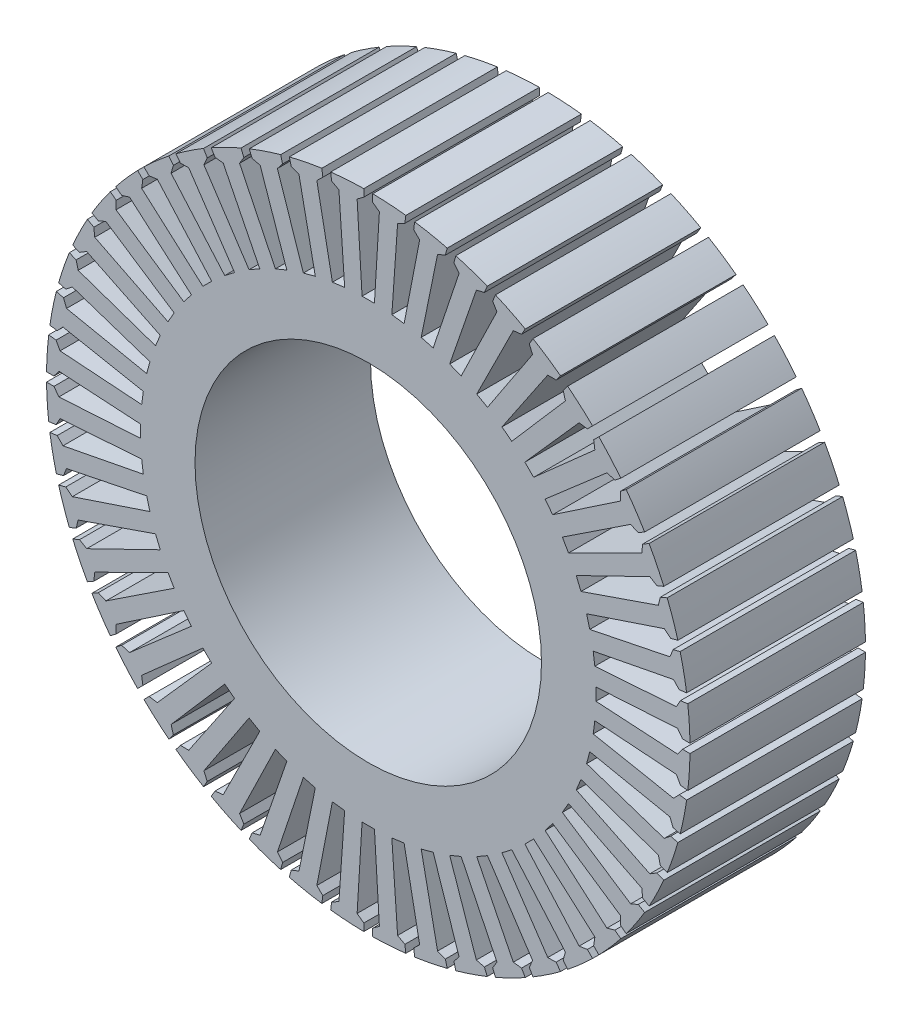
from build123d import *

# Parameters (mm, degrees)
STATOR_STACK_START    = -15
SKETCH_1_R            = 55
SKETCH_1_R_2          = 29.615384615
STATOR_STACK_DEPTH    = 30
STATOR_48_SLOTS_DEPTH = 16


with BuildPart() as part:
    # Эскиз1 → Stator_stack (new body)
    with BuildSketch(Plane.XY.offset(STATOR_STACK_START)):
        Circle(SKETCH_1_R)
        Circle(SKETCH_1_R_2, mode=Mode.SUBTRACT)
    extrude(amount=STATOR_STACK_DEPTH)

    # Эскиз2 → Stator_48_slots (cut, symmetric)
    with BuildSketch(Plane.XY):
        Polygon((55.994821717, -0.761538462), (53.730769231, -0.761538462), (52.884615385, -1.903846154), (38.923076923, -1.057692308), (38.923076923, 1.057692308), (52.884615385, 1.903846154), (53.730769231, 0.761538462), (55.994821717, 0.761538462), align=None)
        Polygon((55.615178971, 6.553767468), (53.370495767, 6.258249318), (52.680681958, 5.015268987), (38.728141154, 4.031837417), (38.452028055, 6.129124624), (52.18367838, 8.790385959), (53.171694336, 7.768296107), (55.41637754, 8.063814257), align=None)
        Polygon((54.283945093, 13.75693662), (52.097038324, 13.170956717), (51.575367457, 11.848571485), (37.870556152, 9.052381285), (37.323054326, 11.095685918), (50.58986417, 15.526519824), (51.702837009, 14.642136053), (53.889743778, 15.228115955), align=None)
        Polygon((52.023897864, 20.724720772), (49.932186111, 19.858305395), (49.587584119, 18.47914164), (36.364995434, 13.9180364), (35.555472789, 15.87239695), (48.130443358, 21.996990629), (49.349329806, 21.265444991), (51.441041559, 22.131860367), align=None)
        Polygon((48.873707318, 27.337899205), (46.912980349, 26.205872962), (46.751343469, 24.793528558), (34.237219563, 18.545550054), (33.179527255, 20.377526869), (44.847497316, 28.091086826), (46.151441888, 27.524896269), (48.112168857, 28.656922512), align=None)
        Polygon((44.887274091, 33.483318604), (43.091080488, 32.105050776), (43.115174371, 30.683691329), (31.523635372, 22.855744204), (30.235870811, 24.533991654), (40.79719816, 33.70453674), (42.163890004, 33.313388941), (43.960083606, 34.691656768), align=None)
        Polygon((40.132807158, 39.055829137), (38.531880292, 37.454902271), (38.741292685, 36.048847633), (28.27067304, 26.774870234), (26.774870234, 28.27067304), (36.048847633, 38.741292685), (37.454902271, 38.531880292), (39.055829137, 40.132807158), align=None)
        Polygon((34.691656768, 43.960083606), (33.313388941, 42.163890004), (33.70453674, 40.79719816), (24.533991654, 30.235870811), (22.855744204, 31.523635372), (30.683691329, 43.115174371), (32.105050776, 43.091080488), (33.483318604, 44.887274091), align=None)
        Polygon((28.656922512, 48.112168857), (27.524896269, 46.151441888), (28.091086826, 44.847497316), (20.377526869, 33.179527255), (18.545550054, 34.237219563), (24.793528558, 46.751343469), (26.205872962, 46.912980349), (27.337899205, 48.873707318), align=None)
        Polygon((22.131860367, 51.441041559), (21.265444991, 49.349329806), (21.996990629, 48.130443358), (15.87239695, 35.555472789), (13.9180364, 36.364995434), (18.47914164, 49.587584119), (19.858305395, 49.932186111), (20.724720772, 52.023897864), align=None)
        Polygon((15.228115955, 53.889743778), (14.642136053, 51.702837009), (15.526519824, 50.58986417), (11.095685918, 37.323054326), (9.052381285, 37.870556152), (11.848571485, 51.575367457), (13.170956717, 52.097038324), (13.75693662, 54.283945093), align=None)
        Polygon((8.063814257, 55.41637754), (7.768296107, 53.171694336), (8.790385959, 52.18367838), (6.129124624, 38.452028055), (4.031837417, 38.728141154), (5.015268987, 52.680681958), (6.258249318, 53.370495767), (6.553767468, 55.615178971), align=None)
        Polygon((0.761538462, 55.994821717), (0.761538462, 53.730769231), (1.903846154, 52.884615385), (1.057692308, 38.923076923), (-1.057692308, 38.923076923), (-1.903846154, 52.884615385), (-0.761538462, 53.730769231), (-0.761538462, 55.994821717), align=None)
        Polygon((-6.553767468, 55.615178971), (-6.258249318, 53.370495767), (-5.015268987, 52.680681958), (-4.031837417, 38.728141154), (-6.129124624, 38.452028055), (-8.790385959, 52.18367838), (-7.768296107, 53.171694336), (-8.063814257, 55.41637754), align=None)
        Polygon((-13.75693662, 54.283945093), (-13.170956717, 52.097038324), (-11.848571485, 51.575367457), (-9.052381285, 37.870556152), (-11.095685918, 37.323054326), (-15.526519824, 50.58986417), (-14.642136053, 51.702837009), (-15.228115955, 53.889743778), align=None)
        Polygon((-20.724720772, 52.023897864), (-19.858305395, 49.932186111), (-18.47914164, 49.587584119), (-13.9180364, 36.364995434), (-15.87239695, 35.555472789), (-21.996990629, 48.130443358), (-21.265444991, 49.349329806), (-22.131860367, 51.441041559), align=None)
        Polygon((-27.337899205, 48.873707318), (-26.205872962, 46.912980349), (-24.793528558, 46.751343469), (-18.545550054, 34.237219563), (-20.377526869, 33.179527255), (-28.091086826, 44.847497316), (-27.524896269, 46.151441888), (-28.656922512, 48.112168857), align=None)
        Polygon((-33.483318604, 44.887274091), (-32.105050776, 43.091080488), (-30.683691329, 43.115174371), (-22.855744204, 31.523635372), (-24.533991654, 30.235870811), (-33.70453674, 40.79719816), (-33.313388941, 42.163890004), (-34.691656768, 43.960083606), align=None)
        Polygon((-39.055829137, 40.132807158), (-37.454902271, 38.531880292), (-36.048847633, 38.741292685), (-26.774870234, 28.27067304), (-28.27067304, 26.774870234), (-38.741292685, 36.048847633), (-38.531880292, 37.454902271), (-40.132807158, 39.055829137), align=None)
        Polygon((-43.960083606, 34.691656768), (-42.163890004, 33.313388941), (-40.79719816, 33.70453674), (-30.235870811, 24.533991654), (-31.523635372, 22.855744204), (-43.115174371, 30.683691329), (-43.091080488, 32.105050776), (-44.887274091, 33.483318604), align=None)
        Polygon((-48.112168857, 28.656922512), (-46.151441888, 27.524896269), (-44.847497316, 28.091086826), (-33.179527255, 20.377526869), (-34.237219563, 18.545550054), (-46.751343469, 24.793528558), (-46.912980349, 26.205872962), (-48.873707318, 27.337899205), align=None)
        Polygon((-51.441041559, 22.131860367), (-49.349329806, 21.265444991), (-48.130443358, 21.996990629), (-35.555472789, 15.87239695), (-36.364995434, 13.9180364), (-49.587584119, 18.47914164), (-49.932186111, 19.858305395), (-52.023897864, 20.724720772), align=None)
        Polygon((-53.889743778, 15.228115955), (-51.702837009, 14.642136053), (-50.58986417, 15.526519824), (-37.323054326, 11.095685918), (-37.870556152, 9.052381285), (-51.575367457, 11.848571485), (-52.097038324, 13.170956717), (-54.283945093, 13.75693662), align=None)
        Polygon((-55.41637754, 8.063814257), (-53.171694336, 7.768296107), (-52.18367838, 8.790385959), (-38.452028055, 6.129124624), (-38.728141154, 4.031837417), (-52.680681958, 5.015268987), (-53.370495767, 6.258249318), (-55.615178971, 6.553767468), align=None)
        Polygon((-55.994821717, 0.761538462), (-53.730769231, 0.761538462), (-52.884615385, 1.903846154), (-38.923076923, 1.057692308), (-38.923076923, -1.057692308), (-52.884615385, -1.903846154), (-53.730769231, -0.761538462), (-55.994821717, -0.761538462), align=None)
        Polygon((-55.615178971, -6.553767468), (-53.370495767, -6.258249318), (-52.680681958, -5.015268987), (-38.728141154, -4.031837417), (-38.452028055, -6.129124624), (-52.18367838, -8.790385959), (-53.171694336, -7.768296107), (-55.41637754, -8.063814257), align=None)
        Polygon((-54.283945093, -13.75693662), (-52.097038324, -13.170956717), (-51.575367457, -11.848571485), (-37.870556152, -9.052381285), (-37.323054326, -11.095685918), (-50.58986417, -15.526519824), (-51.702837009, -14.642136053), (-53.889743778, -15.228115955), align=None)
        Polygon((-52.023897864, -20.724720772), (-49.932186111, -19.858305395), (-49.587584119, -18.47914164), (-36.364995434, -13.9180364), (-35.555472789, -15.87239695), (-48.130443358, -21.996990629), (-49.349329806, -21.265444991), (-51.441041559, -22.131860367), align=None)
        Polygon((-48.873707318, -27.337899205), (-46.912980349, -26.205872962), (-46.751343469, -24.793528558), (-34.237219563, -18.545550054), (-33.179527255, -20.377526869), (-44.847497316, -28.091086826), (-46.151441888, -27.524896269), (-48.112168857, -28.656922512), align=None)
        Polygon((-44.887274091, -33.483318604), (-43.091080488, -32.105050776), (-43.115174371, -30.683691329), (-31.523635372, -22.855744204), (-30.235870811, -24.533991654), (-40.79719816, -33.70453674), (-42.163890004, -33.313388941), (-43.960083606, -34.691656768), align=None)
        Polygon((-40.132807158, -39.055829137), (-38.531880292, -37.454902271), (-38.741292685, -36.048847633), (-28.27067304, -26.774870234), (-26.774870234, -28.27067304), (-36.048847633, -38.741292685), (-37.454902271, -38.531880292), (-39.055829137, -40.132807158), align=None)
        Polygon((-34.691656768, -43.960083606), (-33.313388941, -42.163890004), (-33.70453674, -40.79719816), (-24.533991654, -30.235870811), (-22.855744204, -31.523635372), (-30.683691329, -43.115174371), (-32.105050776, -43.091080488), (-33.483318604, -44.887274091), align=None)
        Polygon((-28.656922512, -48.112168857), (-27.524896269, -46.151441888), (-28.091086826, -44.847497316), (-20.377526869, -33.179527255), (-18.545550054, -34.237219563), (-24.793528558, -46.751343469), (-26.205872962, -46.912980349), (-27.337899205, -48.873707318), align=None)
        Polygon((-22.131860367, -51.441041559), (-21.265444991, -49.349329806), (-21.996990629, -48.130443358), (-15.87239695, -35.555472789), (-13.9180364, -36.364995434), (-18.47914164, -49.587584119), (-19.858305395, -49.932186111), (-20.724720772, -52.023897864), align=None)
        Polygon((-15.228115955, -53.889743778), (-14.642136053, -51.702837009), (-15.526519824, -50.58986417), (-11.095685918, -37.323054326), (-9.052381285, -37.870556152), (-11.848571485, -51.575367457), (-13.170956717, -52.097038324), (-13.75693662, -54.283945093), align=None)
        Polygon((-8.063814257, -55.41637754), (-7.768296107, -53.171694336), (-8.790385959, -52.18367838), (-6.129124624, -38.452028055), (-4.031837417, -38.728141154), (-5.015268987, -52.680681958), (-6.258249318, -53.370495767), (-6.553767468, -55.615178971), align=None)
        Polygon((-0.761538462, -55.994821717), (-0.761538462, -53.730769231), (-1.903846154, -52.884615385), (-1.057692308, -38.923076923), (1.057692308, -38.923076923), (1.903846154, -52.884615385), (0.761538462, -53.730769231), (0.761538462, -55.994821717), align=None)
        Polygon((6.553767468, -55.615178971), (6.258249318, -53.370495767), (5.015268987, -52.680681958), (4.031837417, -38.728141154), (6.129124624, -38.452028055), (8.790385959, -52.18367838), (7.768296107, -53.171694336), (8.063814257, -55.41637754), align=None)
        Polygon((13.75693662, -54.283945093), (13.170956717, -52.097038324), (11.848571485, -51.575367457), (9.052381285, -37.870556152), (11.095685918, -37.323054326), (15.526519824, -50.58986417), (14.642136053, -51.702837009), (15.228115955, -53.889743778), align=None)
        Polygon((20.724720772, -52.023897864), (19.858305395, -49.932186111), (18.47914164, -49.587584119), (13.9180364, -36.364995434), (15.87239695, -35.555472789), (21.996990629, -48.130443358), (21.265444991, -49.349329806), (22.131860367, -51.441041559), align=None)
        Polygon((27.337899205, -48.873707318), (26.205872962, -46.912980349), (24.793528558, -46.751343469), (18.545550054, -34.237219563), (20.377526869, -33.179527255), (28.091086826, -44.847497316), (27.524896269, -46.151441888), (28.656922512, -48.112168857), align=None)
        Polygon((33.483318604, -44.887274091), (32.105050776, -43.091080488), (30.683691329, -43.115174371), (22.855744204, -31.523635372), (24.533991654, -30.235870811), (33.70453674, -40.79719816), (33.313388941, -42.163890004), (34.691656768, -43.960083606), align=None)
        Polygon((39.055829137, -40.132807158), (37.454902271, -38.531880292), (36.048847633, -38.741292685), (26.774870234, -28.27067304), (28.27067304, -26.774870234), (38.741292685, -36.048847633), (38.531880292, -37.454902271), (40.132807158, -39.055829137), align=None)
        Polygon((43.960083606, -34.691656768), (42.163890004, -33.313388941), (40.79719816, -33.70453674), (30.235870811, -24.533991654), (31.523635372, -22.855744204), (43.115174371, -30.683691329), (43.091080488, -32.105050776), (44.887274091, -33.483318604), align=None)
        Polygon((48.112168857, -28.656922512), (46.151441888, -27.524896269), (44.847497316, -28.091086826), (33.179527255, -20.377526869), (34.237219563, -18.545550054), (46.751343469, -24.793528558), (46.912980349, -26.205872962), (48.873707318, -27.337899205), align=None)
        Polygon((51.441041559, -22.131860367), (49.349329806, -21.265444991), (48.130443358, -21.996990629), (35.555472789, -15.87239695), (36.364995434, -13.9180364), (49.587584119, -18.47914164), (49.932186111, -19.858305395), (52.023897864, -20.724720772), align=None)
        Polygon((53.889743778, -15.228115955), (51.702837009, -14.642136053), (50.58986417, -15.526519824), (37.323054326, -11.095685918), (37.870556152, -9.052381285), (51.575367457, -11.848571485), (52.097038324, -13.170956717), (54.283945093, -13.75693662), align=None)
        Polygon((55.41637754, -8.063814257), (53.171694336, -7.768296107), (52.18367838, -8.790385959), (38.452028055, -6.129124624), (38.728141154, -4.031837417), (52.680681958, -5.015268987), (53.370495767, -6.258249318), (55.615178971, -6.553767468), align=None)
    extrude(amount=STATOR_48_SLOTS_DEPTH, both=True, mode=Mode.SUBTRACT)


solid = part.part
